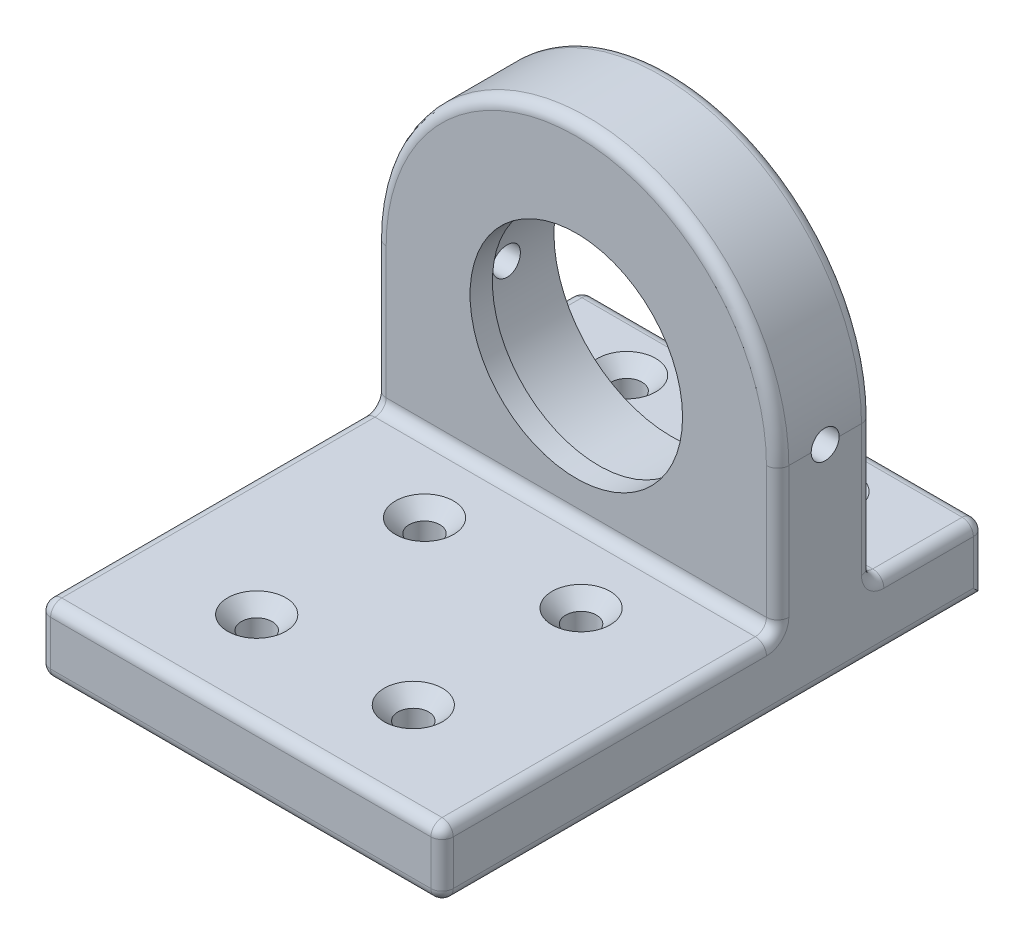
from build123d import *

# Parameters (mm, degrees)
SKETCH1_R                                            = 21
BOSS_EXTRUDE1_DEPTH                                  = 17
BOSS_EXTRUDE2_DEPTH                                  = 60
BOSS_EXTRUDE2_DEPTH_BACK                             = 37
SKETCH2_W                                            = 72
SKETCH2_H                                            = 12
FILLET1_R                                            = 2
BOSS_EXTRUDE4_START                                  = -4
SKETCH4_R                                            = 21
SKETCH4_R_2                                          = 19
BOSS_EXTRUDE4_DEPTH                                  = 4
SKETCH7_R                                            = 2.5
CUT_EXTRUDE3_DEPTH                                   = 112.889454374
CSK_FOR_M5_COUNTERSUNK_RAISED_HEAD_SCREW_D           = 5.5
CSK_FOR_M5_COUNTERSUNK_RAISED_HEAD_SCREW_CSINK_D     = 10.4
CSK_FOR_M5_COUNTERSUNK_RAISED_HEAD_SCREW_CSINK_ANGLE = 90


with BuildPart() as part:
    # Sketch1 → Boss-Extrude1 (new body)
    with BuildSketch(Plane.XY):
        with BuildLine():
            Line((-36, 0), (-36, -37.5))
            Line((-36, -37.5), (36, -37.5))
            Line((36, -37.5), (36, 0))
            ThreePointArc((36, 0), (0, 36), (-36, 0))
        make_face()
        Circle(SKETCH1_R, mode=Mode.SUBTRACT)
    extrude(amount=BOSS_EXTRUDE1_DEPTH)

    # Sketch2 → Boss-Extrude2 (add, two sides: drawn at the far end of the back side and taken through both)
    with BuildSketch(Plane.XY.offset(17).offset(-BOSS_EXTRUDE2_DEPTH_BACK)):
        with Locations((0, -31.5)):
            Rectangle(SKETCH2_W, SKETCH2_H)
    extrude(amount=BOSS_EXTRUDE2_DEPTH + BOSS_EXTRUDE2_DEPTH_BACK)

    # Fillet1
    fillet1_edges = [part.edges().sort_by_distance(p)[0] for p in [
        (36, -12.75, 0),
        (36, -12.75, 17),
        (36, -31.5, -20),
        (36, -25.5, -10),
        (-36, -31.5, -20),
        (0, -25.5, 0),
        (0, -25.5, -20),
        (-36, -25.5, -10),
        (36, -25.5, 47),
        (0, -25.5, 17),
        (-36, -25.5, 47),
        (36, -31.5, 77),
        (0, -25.5, 77),
        (-36, -31.5, 77),
        (0, -37.5, 77),
        (0, 36, 17),
        (-36, -12.75, 0),
        (0, 36, 0),
        (36, -37.5, 28.5),
        (-36, -37.5, 28.5),
        (-36, -12.75, 17),
    ]]
    fillet(fillet1_edges, radius=FILLET1_R)

    # Sketch4 → Boss-Extrude4 (add)
    with BuildSketch(Plane.XY.offset(17).offset(BOSS_EXTRUDE4_START)):
        Circle(SKETCH4_R)
        Circle(SKETCH4_R_2, mode=Mode.SUBTRACT)
    extrude(amount=BOSS_EXTRUDE4_DEPTH)

    # Sketch7 → Cut-Extrude3 (cut, through all)
    with BuildSketch(Plane(origin=(36, 0, 0), x_dir=(0, 0, -1), z_dir=(1, 0, 0))):
        with Locations((-8.5, 0)):
            Circle(SKETCH7_R)
    extrude(amount=-CUT_EXTRUDE3_DEPTH, mode=Mode.SUBTRACT)

    # CSK for M5 Countersunk Raised Head Screw1 (through all)
    with Locations(Plane(origin=(-14, -25.5, 60.144417791), x_dir=(1, 0, 0), z_dir=(0, 1, 0))):
        with Locations((0, 0), (28, 0), (-4, 70.144417791), (32, 70.144417791), (0, 30), (28, 30)):
            CounterSinkHole(CSK_FOR_M5_COUNTERSUNK_RAISED_HEAD_SCREW_D / 2, CSK_FOR_M5_COUNTERSUNK_RAISED_HEAD_SCREW_CSINK_D / 2, counter_sink_angle=CSK_FOR_M5_COUNTERSUNK_RAISED_HEAD_SCREW_CSINK_ANGLE)


solid = part.part
